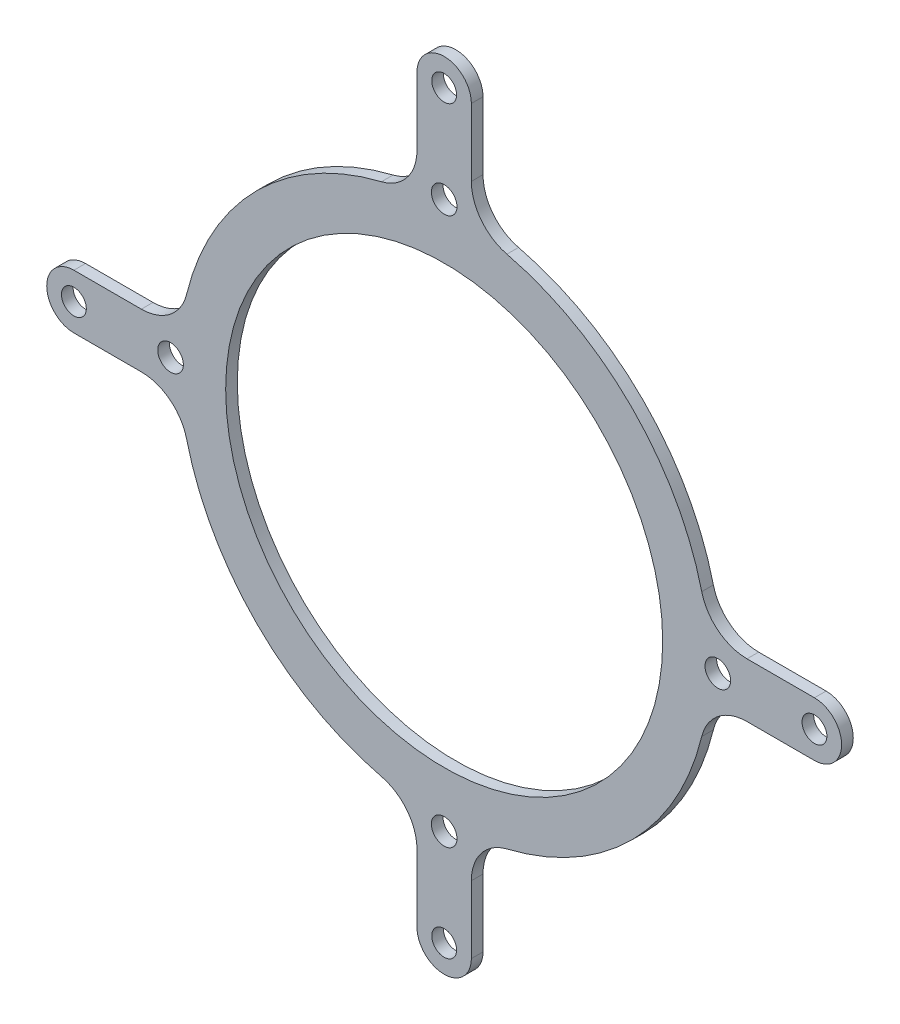
from build123d import *

# Parameters (mm, degrees)
SKETCH_1_R          = 34.15
SKETCH_1_R_2        = 28.15
SKETCH_1_R_3        = 1.6
EXTRUDE_1_DEPTH     = 1.5
FILLET_1_R          = 6
SKETCH_3_R          = 1.65
CUT_EXTRUDE_1_DEPTH = 3


with BuildPart() as part:
    # 草图1 → 凸台-拉伸1 (new body)
    # profile 1 of 5: a face of its own
    with BuildSketch(Plane.XY):
        Circle(SKETCH_1_R)
        Circle(SKETCH_1_R_2, mode=Mode.SUBTRACT)
    # profile 2 of 5: a face of its own
    with BuildSketch(Plane.XY):
        with BuildLine():
            Line((3.5, 47.7), (3.5, 34.15))
            ThreePointArc((3.5, 34.15), (0, 30.65), (-3.5, 34.15))
            Line((-3.5, 34.15), (-3.5, 47.7))
            ThreePointArc((-3.5, 47.7), (0, 51.2), (3.5, 47.7))
        make_face()
        with Locations((0, 47.7)):
            Circle(SKETCH_1_R_3, mode=Mode.SUBTRACT)
    # profile 3 of 5: a face of its own
    with BuildSketch(Plane.XY):
        with BuildLine():
            Line((47.7, -3.5), (34.15, -3.5))
            ThreePointArc((34.15, -3.5), (30.65, 0), (34.15, 3.5))
            Line((34.15, 3.5), (47.7, 3.5))
            ThreePointArc((47.7, 3.5), (51.2, 0), (47.7, -3.5))
        make_face()
        with Locations((47.7, 0)):
            Circle(SKETCH_1_R_3, mode=Mode.SUBTRACT)
    # profile 4 of 5: a face of its own
    with BuildSketch(Plane.XY):
        with BuildLine():
            Line((-3.5, -47.7), (-3.5, -34.15))
            ThreePointArc((-3.5, -34.15), (0, -30.65), (3.5, -34.15))
            Line((3.5, -34.15), (3.5, -47.7))
            ThreePointArc((3.5, -47.7), (0, -51.2), (-3.5, -47.7))
        make_face()
        with Locations((0, -47.7)):
            Circle(SKETCH_1_R_3, mode=Mode.SUBTRACT)
    # profile 5 of 5: a face of its own
    with BuildSketch(Plane.XY):
        with BuildLine():
            Line((-47.7, 3.5), (-34.15, 3.5))
            ThreePointArc((-34.15, 3.5), (-30.65, 0), (-34.15, -3.5))
            Line((-34.15, -3.5), (-47.7, -3.5))
            ThreePointArc((-47.7, -3.5), (-51.2, 0), (-47.7, 3.5))
        make_face()
        with Locations((-47.7, 0)):
            Circle(SKETCH_1_R_3, mode=Mode.SUBTRACT)
    extrude(amount=EXTRUDE_1_DEPTH)

    # 圆角1
    fillet_1_edges = [part.edges().sort_by_distance(p)[0] for p in [
        (-3.49540148, 33.970644217, 0.75),
        (3.49540148, 33.970644217, 0.75),
        (33.970644217, 3.49540148, 0.75),
        (33.970644217, -3.49540148, 0.75),
        (3.49540148, -33.970644217, 0.75),
        (-3.49540148, -33.970644217, 0.75),
        (-33.970644217, -3.49540148, 0.75),
        (-33.970644217, 3.49540148, 0.75),
    ]]
    fillet(fillet_1_edges, radius=FILLET_1_R)

    # 草图3 → 切除-拉伸1 (cut)
    with BuildSketch(Plane.XY.offset(1.5)):
        with Locations((-35.25, 0)):
            Circle(SKETCH_3_R)
        with Locations((0, 35.25)):
            Circle(SKETCH_3_R)
        with Locations((35.25, 0)):
            Circle(SKETCH_3_R)
        with Locations((0, -35.25)):
            Circle(SKETCH_3_R)
    extrude(amount=-CUT_EXTRUDE_1_DEPTH, mode=Mode.SUBTRACT)


solid = part.part
